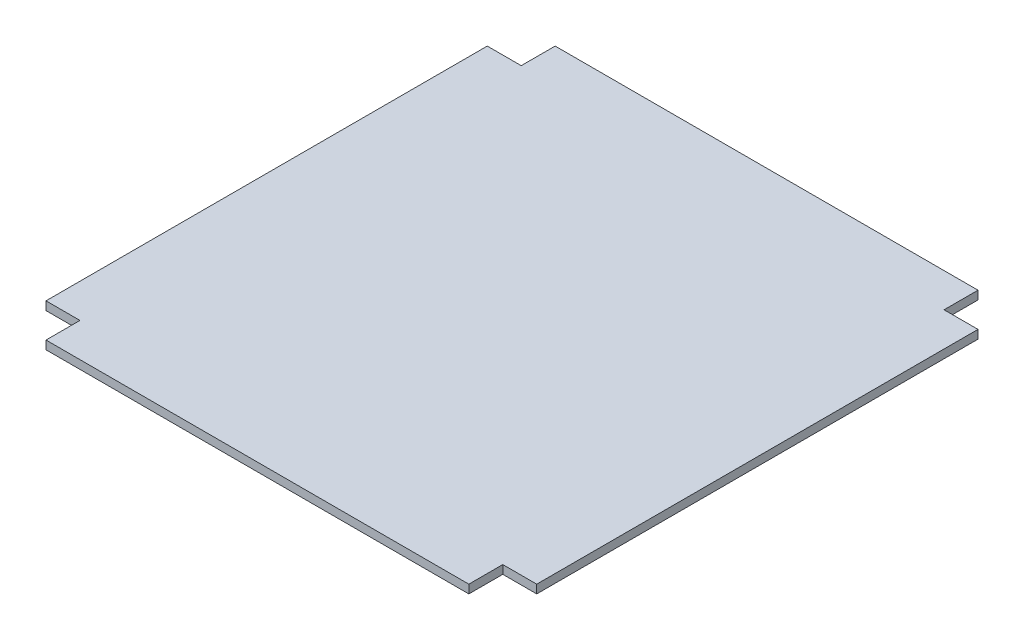
from build123d import *

# Parameters (mm, degrees)
BOSS_EXTRU_1_DEPTH = 5


with BuildPart() as part:
    # Esquisse1 → Boss.-Extru.1 (new body)
    with BuildSketch(Plane(origin=(0, 0, 0), x_dir=(1, 0, 0), z_dir=(0, 1, 0))):
        Polygon((144.568322948, 130), (124.568322948, 130), (124.568322948, 150), (-124.568322948, 150), (-124.568322948, 130), (-144.568322948, 130), (-144.568322948, -130), (-124.568322948, -130), (-124.568322948, -150), (124.568322948, -150), (124.568322948, -130), (144.568322948, -130), align=None)
    extrude(amount=BOSS_EXTRU_1_DEPTH)


solid = part.part
